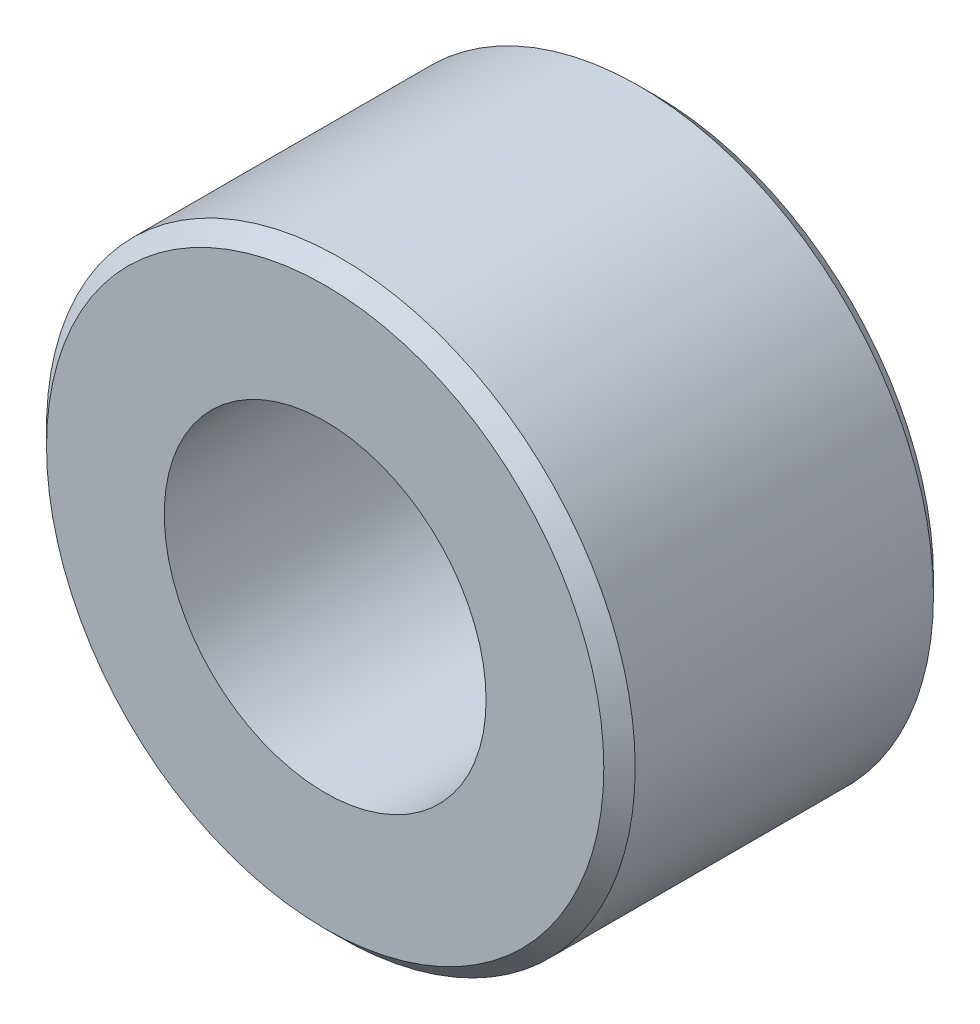
from build123d import *

# Parameters (mm, degrees)
SKETCH1_R           = 7.5
SKETCH1_R_2         = 4.1
BOSS_EXTRUDE1_DEPTH = 4.2
CHAMFER1_SIZE       = 0.4


with BuildPart() as part:
    # Sketch1 → Boss-Extrude1 (new, symmetric)
    with BuildSketch(Plane.XY):
        Circle(SKETCH1_R)
        Circle(SKETCH1_R_2, mode=Mode.SUBTRACT)
    extrude(amount=BOSS_EXTRUDE1_DEPTH, both=True)

    # Chamfer1
    chamfer1_edges = [part.edges().sort_by_distance(p)[0] for p in [
        (-7.5, 0, -4.2),
        (-7.5, 0, 4.2),
    ]]
    chamfer(chamfer1_edges, length=CHAMFER1_SIZE)


solid = part.part
